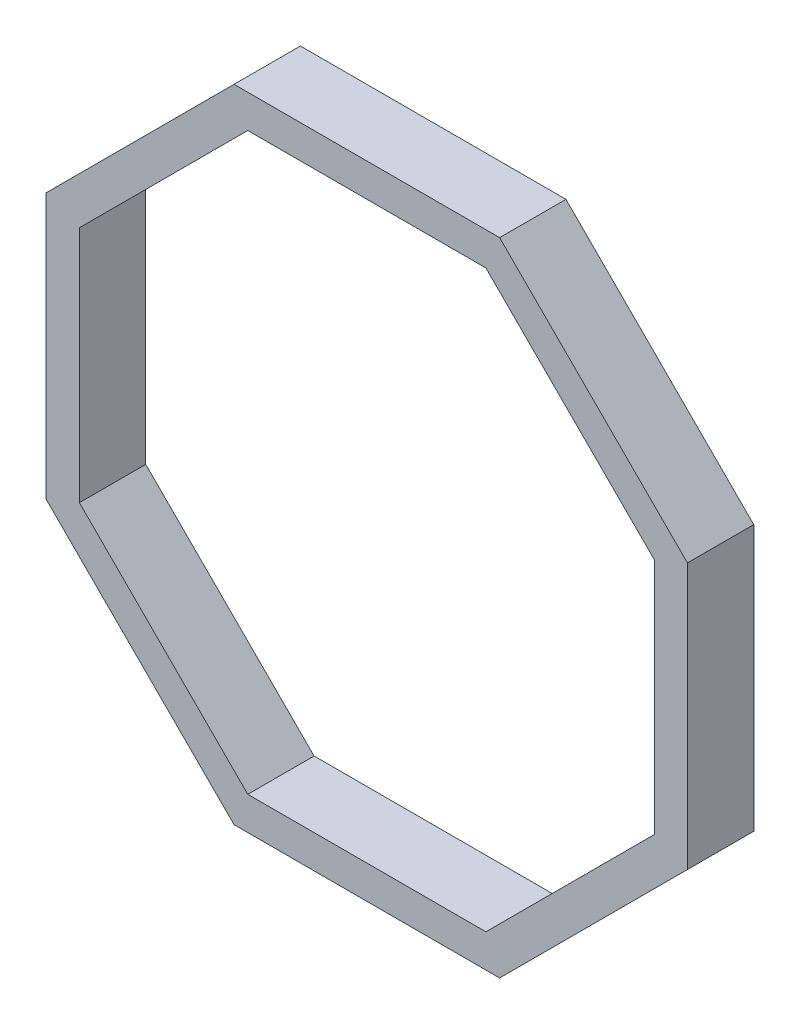
from build123d import *

# Parameters (mm, degrees)
RESSALTO_EXTRUS_O1_DEPTH = 30


with BuildPart() as part:
    # Esboço1 → Ressalto-extrusão1 (new body)
    with BuildSketch(Plane.XY):
        Polygon((145, 60.060966544), (60.060966544, 145), (-60.060966544, 145), (-145, 60.060966544), (-145, -60.060966544), (-60.060966544, -145), (60.060966544, -145), (145, -60.060966544), align=None)
        Polygon((130, 53.847763109), (53.847763109, 130), (-53.847763109, 130), (-130, 53.847763109), (-130, -53.847763109), (-53.847763109, -130), (53.847763109, -130), (130, -53.847763109), align=None, mode=Mode.SUBTRACT)
    extrude(amount=RESSALTO_EXTRUS_O1_DEPTH)


solid = part.part
